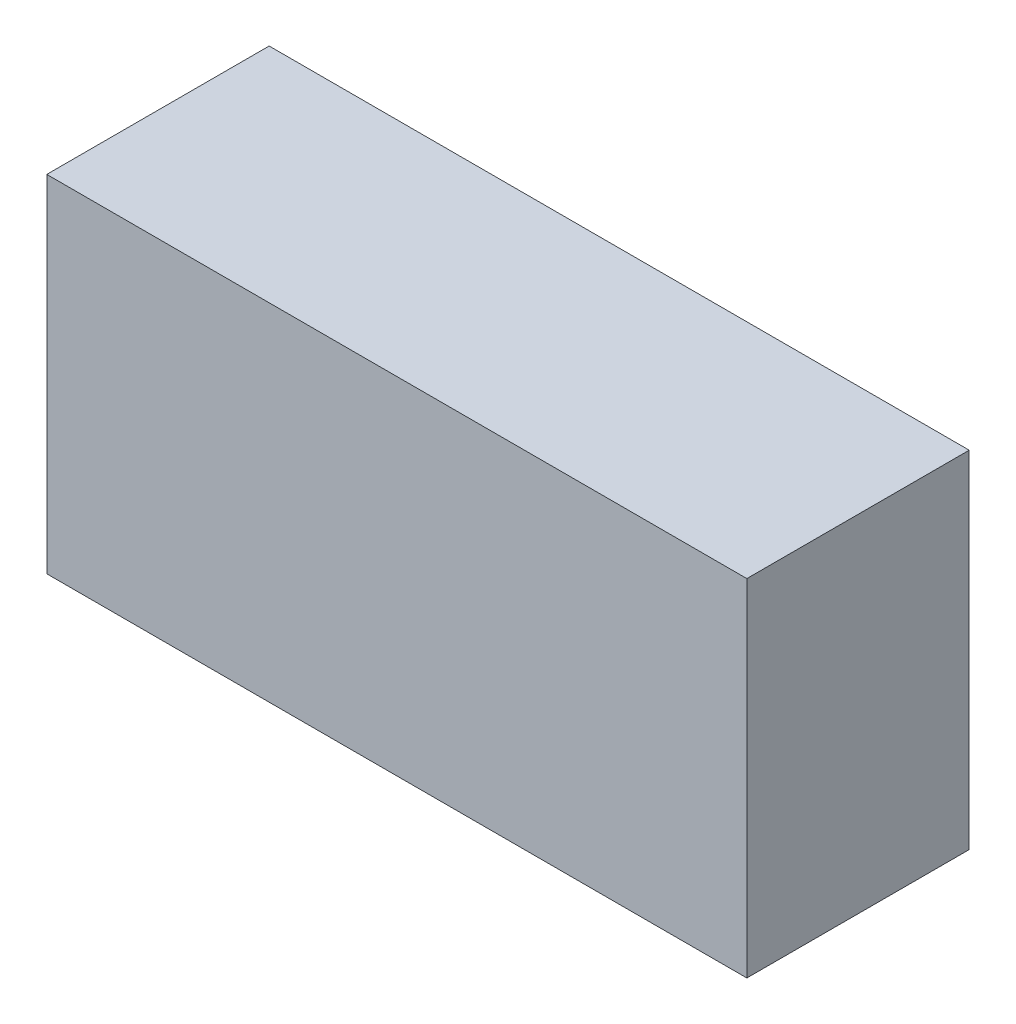
from build123d import *

# Parameters (mm, degrees)
SKETCH1_W           = 85
SKETCH1_H           = 42
BOSS_EXTRUDE1_DEPTH = 27


with BuildPart() as part:
    # Sketch1 → Boss-Extrude1 (new body)
    with BuildSketch(Plane.XY):
        with Locations((42.5, -21)):
            Rectangle(SKETCH1_W, SKETCH1_H)
    extrude(amount=BOSS_EXTRUDE1_DEPTH)


solid = part.part
